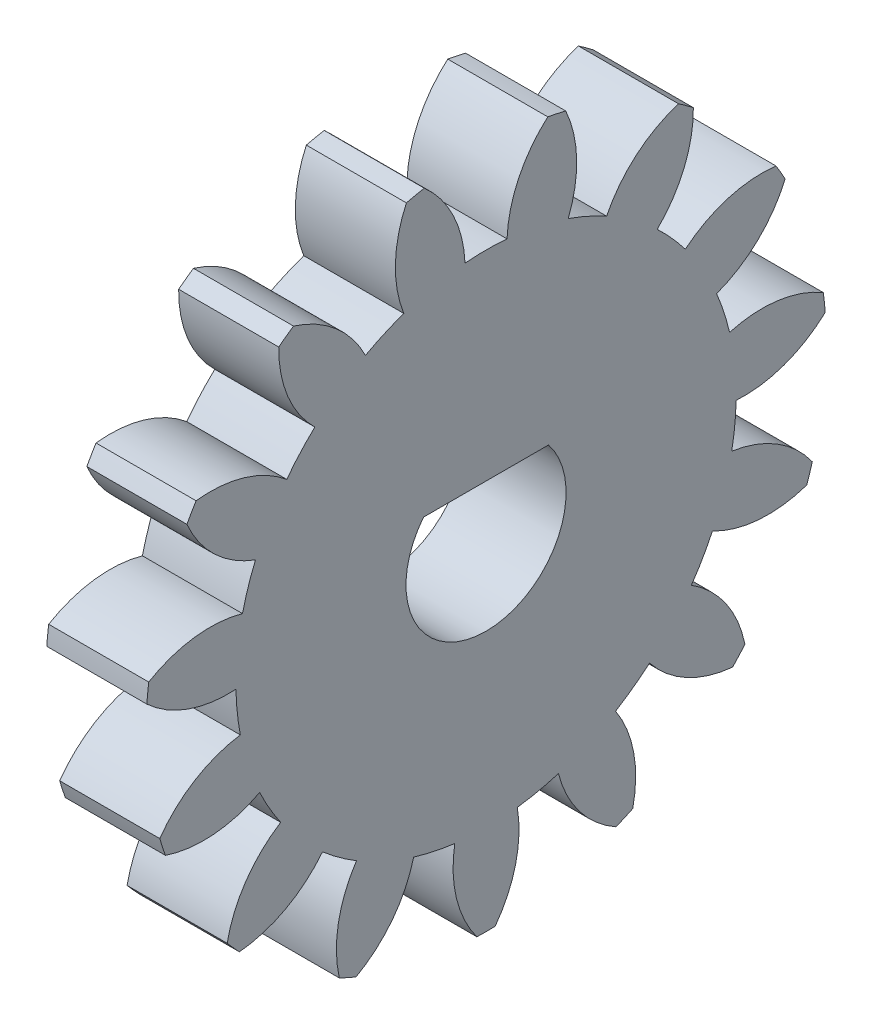
from build123d import *

# Parameters (mm, degrees)
BASPROSKE_W         = 5
BASPROSKE_H         = 17
TOOTHCUT_DEPTH      = 25.556058316
TEETHCUTS_COUNT     = 15
TEETHCUTS_ANGLE     = 336
BORSKE_R            = 4
BORE_DEPTH          = 50.0000508
BOSS_EXTRUDE1_DEPTH = 5


with BuildPart() as part:
    # BasProSke → Base-Revolve (revolve)
    with BuildSketch(Plane(origin=(0, 0, 0), x_dir=(1, 0, 0), z_dir=(0, 1, 0)), mode=Mode.PRIVATE) as base_revolve_sk:
        with Locations((2.5, 8.5)):
            Rectangle(BASPROSKE_W, BASPROSKE_H)
    revolve(base_revolve_sk.sketch.rotate(Axis((-10, 0, 0), (1, 0, 0)), 180), axis=Axis((-10, 0, 0), (1, 0, 0)))

    # TooCutSke → ToothCut (cut, through all)
    with BuildSketch(Plane(origin=(0, 0, 0), x_dir=(0, 0, -1), z_dir=(1, 0, 0))):
        with BuildLine():
            ThreePointArc((1.050056448, 12.454813626), (0, 12.499), (-1.050056448, 12.454813626))
            ThreePointArc((-1.050056448, 12.454813626), (-1.638118106, 14.809604533), (-3.110934279, 16.73876737))
            ThreePointArc((-3.110934279, 16.73876737), (0, 17.0254), (3.110934279, 16.73876737))
            ThreePointArc((3.110934279, 16.73876737), (1.638118106, 14.809604533), (1.050056448, 12.454813626))
        make_face()
    toothcut = extrude(amount=TOOTHCUT_DEPTH, mode=Mode.SUBTRACT)

    # TeethCuts: ToothCut ×15 about axis
    teethcuts_axis = Axis((-10, 0, 0), (1, 0, 0))
    for i in range(1, TEETHCUTS_COUNT):
        add(toothcut.rotate(teethcuts_axis, i * TEETHCUTS_ANGLE / (TEETHCUTS_COUNT - 1)), mode=Mode.SUBTRACT)

    # BorSke → Bore (cut, symmetric)
    with BuildSketch(Plane(origin=(0, 0, 0), x_dir=(0, 0, -1), z_dir=(1, 0, 0))):
        with Locations(Location((0, 0, 0), (0, 0, 180))):
            Circle(BORSKE_R)
    extrude(amount=BORE_DEPTH, both=True, mode=Mode.SUBTRACT)

    # Sketch1 → Boss-Extrude1 (add)
    with BuildSketch(Plane(origin=(5, 0, 0), x_dir=(0, 0, -1), z_dir=(1, 0, 0))):
        with BuildLine():
            Line((3.122498999, 2.5), (-3.122498999, 2.5))
            ThreePointArc((-3.122498999, 2.5), (0, 4), (3.122498999, 2.5))
        make_face()
    extrude(amount=-BOSS_EXTRUDE1_DEPTH)


solid = part.part
